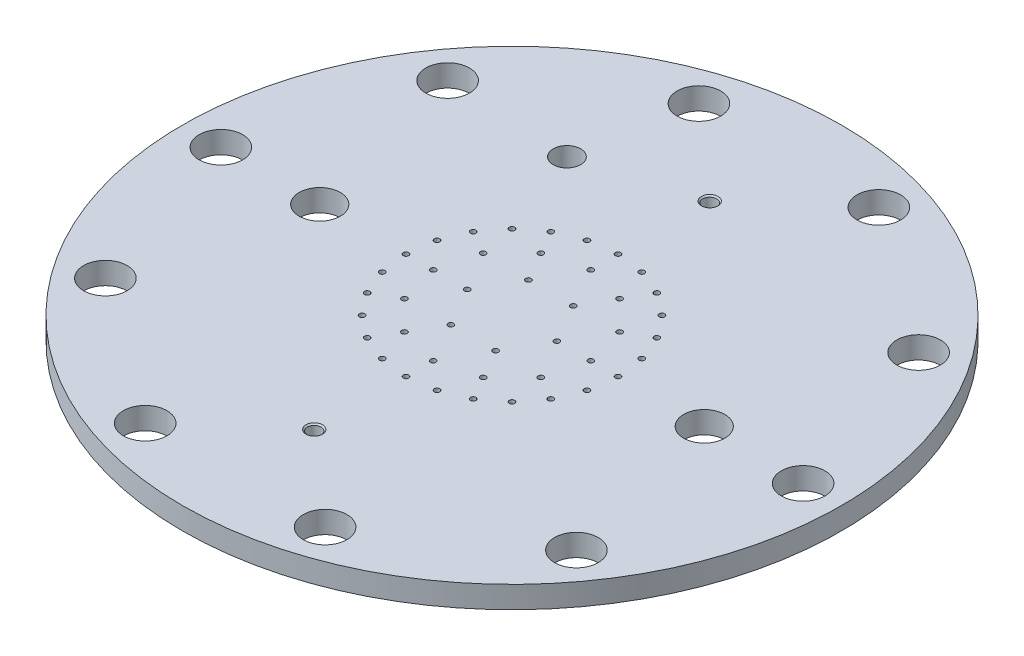
from build123d import *

# Parameters (mm, degrees)
F_3_8_CLEARANCE_HOLE1_D                = 10.0838
CIRPATTERN1_COUNT                      = 10
F_3_8_0_375_DIAMETER_HOLE1_D           = 9.525
F_1_4_0_25_DIAMETER_HOLE1_D            = 6.35
CUT_EXTRUDE1_DEPTH                     = 108.882743755
CUT_EXTRUDE1_DEPTH_BACK                = 108.882743755
SKETCH7_R                              = 0.635
F_1_8_0_125_DIAMETER_HOLE1_D           = 3.175
F_1_8_0_125_DIAMETER_HOLE1_CSINK_D     = 3.81
F_1_8_0_125_DIAMETER_HOLE1_CSINK_ANGLE = 90


with BuildPart() as part:
    # Sketch1 → Revolve1 (revolve)
    with BuildSketch(Plane.XY, mode=Mode.PRIVATE) as revolve1_sk:
        Polygon((0, 0), (0, -5.08), (54.8259, -5.08), (54.8259, -2.3876), (58.8899, -2.3876), (58.8899, -5.08), (76.2, -5.08), (76.2, 0), align=None)
    revolve(revolve1_sk.sketch.rotate(Axis((0, 0, 0), (0, -1, 0)), 90), axis=Axis((0, 0, 0), (0, -1, 0)))

    # 3/8 Clearance Hole1 (through all)
    with Locations(Plane(origin=(67.31, 0, 0), x_dir=(0, 0, 1), z_dir=(0, 1, 0))):
        with Locations((0, 0)):
            f_3_8_clearance_hole1 = Hole(F_3_8_CLEARANCE_HOLE1_D / 2)

    # CirPattern1: 3/8 Clearance Hole1 ×10 about axis
    cirpattern1_axis = Axis((0, 0, 0), (0, 1, 0))
    for i in range(1, CIRPATTERN1_COUNT):
        add(f_3_8_clearance_hole1.rotate(cirpattern1_axis, i * 360 / CIRPATTERN1_COUNT), mode=Mode.SUBTRACT)

    # 3/8 (0.375) Diameter Hole1 (through all)
    with Locations(Plane(origin=(44.45, 0, 0), x_dir=(0, 0, 1), z_dir=(0, 1, 0))):
        with Locations((0, 0), (0, -88.9)):
            Hole(F_3_8_0_375_DIAMETER_HOLE1_D / 2)

    # 1/4 (0.25) Diameter Hole1 (through all)
    with Locations(Plane(origin=(-25.4, 0, -38.1), x_dir=(0, 0, 1), z_dir=(0, 1, 0))):
        with Locations((0, 0)):
            Hole(F_1_4_0_25_DIAMETER_HOLE1_D / 2)

    # Sketch7 → Cut-Extrude1 (cut, two sides: drawn at the far end of the back side and taken through both)
    with BuildSketch(Plane(origin=(0, 0, 0), x_dir=(1, 0, 0), z_dir=(0, 1, 0)).offset(-CUT_EXTRUDE1_DEPTH_BACK)):
        with Locations(Location((10.3632, 0, 0), (0, 0, 270))):
            Circle(SKETCH7_R)
        with Locations(Location((18.2118, 0, 0), (0, 0, 270))):
            Circle(SKETCH7_R)
        with Locations(Location((24.511, 0, 0), (0, 0, 270))):
            Circle(SKETCH7_R)
        with Locations(Location((5.1816, -8.974794464, 0), (0, 0, 270))):
            Circle(SKETCH7_R)
        with Locations(Location((-5.1816, -8.974794464, 0), (0, 0, 270))):
            Circle(SKETCH7_R)
        with Locations(Location((-10.3632, 0, 0), (0, 0, 270))):
            Circle(SKETCH7_R)
        with Locations(Location((-5.1816, 8.974794464, 0), (0, 0, 270))):
            Circle(SKETCH7_R)
        with Locations(Location((5.1816, 8.974794464, 0), (0, 0, 270))):
            Circle(SKETCH7_R)
        with Locations(Location((15.771881449, -9.1059, 0), (0, 0, 270))):
            Circle(SKETCH7_R)
        with Locations(Location((9.1059, -15.771881449, 0), (0, 0, 270))):
            Circle(SKETCH7_R)
        with Locations(Location((0, -18.2118, 0), (0, 0, 270))):
            Circle(SKETCH7_R)
        with Locations(Location((-9.1059, -15.771881449, 0), (0, 0, 270))):
            Circle(SKETCH7_R)
        with Locations(Location((-15.771881449, -9.1059, 0), (0, 0, 270))):
            Circle(SKETCH7_R)
        with Locations(Location((-18.2118, 0, 0), (0, 0, 270))):
            Circle(SKETCH7_R)
        with Locations(Location((-15.771881449, 9.1059, 0), (0, 0, 270))):
            Circle(SKETCH7_R)
        with Locations(Location((-9.1059, 15.771881449, 0), (0, 0, 270))):
            Circle(SKETCH7_R)
        with Locations(Location((0, 18.2118, 0), (0, 0, 270))):
            Circle(SKETCH7_R)
        with Locations(Location((9.1059, 15.771881449, 0), (0, 0, 270))):
            Circle(SKETCH7_R)
        with Locations(Location((15.771881449, 9.1059, 0), (0, 0, 270))):
            Circle(SKETCH7_R)
        with Locations(Location((23.675807928, -6.343913615, 0), (0, 0, 270))):
            Circle(SKETCH7_R)
        with Locations(Location((21.227148672, -12.2555, 0), (0, 0, 270))):
            Circle(SKETCH7_R)
        with Locations(Location((17.331894314, -17.331894314, 0), (0, 0, 270))):
            Circle(SKETCH7_R)
        with Locations(Location((12.2555, -21.227148672, 0), (0, 0, 270))):
            Circle(SKETCH7_R)
        with Locations(Location((6.343913615, -23.675807928, 0), (0, 0, 270))):
            Circle(SKETCH7_R)
        with Locations(Location((0, -24.511, 0), (0, 0, 270))):
            Circle(SKETCH7_R)
        with Locations(Location((-6.343913615, -23.675807928, 0), (0, 0, 270))):
            Circle(SKETCH7_R)
        with Locations(Location((-12.2555, -21.227148672, 0), (0, 0, 270))):
            Circle(SKETCH7_R)
        with Locations(Location((-17.331894314, -17.331894314, 0), (0, 0, 270))):
            Circle(SKETCH7_R)
        with Locations(Location((-21.227148672, -12.2555, 0), (0, 0, 270))):
            Circle(SKETCH7_R)
        with Locations(Location((-23.675807928, -6.343913615, 0), (0, 0, 270))):
            Circle(SKETCH7_R)
        with Locations(Location((-24.511, 0, 0), (0, 0, 270))):
            Circle(SKETCH7_R)
        with Locations(Location((-23.675807928, 6.343913615, 0), (0, 0, 270))):
            Circle(SKETCH7_R)
        with Locations(Location((-21.227148672, 12.2555, 0), (0, 0, 270))):
            Circle(SKETCH7_R)
        with Locations(Location((-17.331894314, 17.331894314, 0), (0, 0, 270))):
            Circle(SKETCH7_R)
        with Locations(Location((-12.2555, 21.227148672, 0), (0, 0, 270))):
            Circle(SKETCH7_R)
        with Locations(Location((-6.343913615, 23.675807928, 0), (0, 0, 270))):
            Circle(SKETCH7_R)
        with Locations(Location((0, 24.511, 0), (0, 0, 270))):
            Circle(SKETCH7_R)
        with Locations(Location((6.343913615, 23.675807928, 0), (0, 0, 270))):
            Circle(SKETCH7_R)
        with Locations(Location((12.2555, 21.227148672, 0), (0, 0, 270))):
            Circle(SKETCH7_R)
        with Locations(Location((17.331894314, 17.331894314, 0), (0, 0, 270))):
            Circle(SKETCH7_R)
        with Locations(Location((21.227148672, 12.2555, 0), (0, 0, 270))):
            Circle(SKETCH7_R)
        with Locations(Location((23.675807928, 6.343913615, 0), (0, 0, 270))):
            Circle(SKETCH7_R)
    extrude(amount=CUT_EXTRUDE1_DEPTH + CUT_EXTRUDE1_DEPTH_BACK, mode=Mode.SUBTRACT)

    # 1/8 (0.125) Diameter Hole1 (through all)
    with Locations(Plane(origin=(0, 0, 45.72), x_dir=(0, 0, 1), z_dir=(0, 1, 0))):
        with Locations((0, 0), (-91.44, 0)):
            CounterSinkHole(F_1_8_0_125_DIAMETER_HOLE1_D / 2, F_1_8_0_125_DIAMETER_HOLE1_CSINK_D / 2, counter_sink_angle=F_1_8_0_125_DIAMETER_HOLE1_CSINK_ANGLE)


solid = part.part
